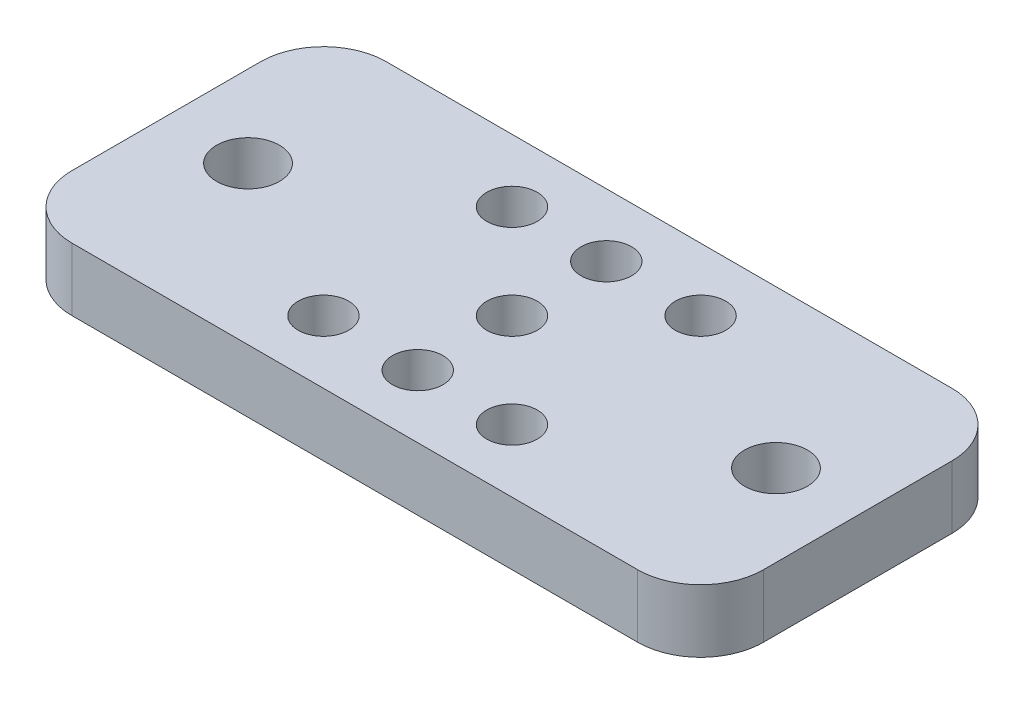
from build123d import *

# Parameters (mm, degrees)
SKETCH1_R           = 2.552698787
SKETCH1_R_2         = 2.5527
SKETCH1_R_3         = 3.175
BOSS_EXTRUDE2_DEPTH = 3.175


with BuildPart() as part:
    # Sketch1 → Boss-Extrude2 (new, symmetric)
    with BuildSketch(Plane(origin=(0, 0, 0), x_dir=(1, 0, 0), z_dir=(0, 1, 0))):
        with BuildLine():
            Line((-28.575, -15.875), (28.575, -15.875))
            add(Edge.make_bspline(
                [(28.575, -15.875), (29.157862345, -15.875), (29.730465383, -15.768989089), (30.338469644, -15.656424047), (30.912401406, -15.429155712), (31.511428211, -15.191950117), (32.049781934, -14.839921496), (32.600578196, -14.479756719), (33.065128061, -14.015128061), (33.530435301, -13.549741898), (33.889921496, -12.999781934), (34.242433686, -12.460491153), (34.479155712, -11.862401406), (34.706715402, -11.287460745), (34.818989089, -10.680465383), (34.925, -10.107329034), (34.925, -9.525)],
                knots=[0, 0, 0, 0.125, 0.125, 0.25, 0.25, 0.375, 0.375, 0.5, 0.5, 0.625, 0.625, 0.75, 0.75, 0.875, 0.875, 1, 1, 1], degree=2))
            Line((34.925, -9.525), (34.925, 9.525))
            add(Edge.make_bspline(
                [(34.925, 9.525), (34.925, 10.107862345), (34.818989089, 10.680465383), (34.706424047, 11.288469644), (34.479155712, 11.862401406), (34.241950117, 12.461428211), (33.889921496, 12.999781934), (33.529756719, 13.550578196), (33.065128061, 14.015128061), (32.599741898, 14.480435301), (32.049781934, 14.839921496), (31.510491153, 15.192433686), (30.912401406, 15.429155712), (30.337460745, 15.656715402), (29.730465383, 15.768989089), (29.157329034, 15.875), (28.575, 15.875)],
                knots=[0, 0, 0, 0.125, 0.125, 0.25, 0.25, 0.375, 0.375, 0.5, 0.5, 0.625, 0.625, 0.75, 0.75, 0.875, 0.875, 1, 1, 1], degree=2))
            Line((28.575, 15.875), (-28.575, 15.875))
            add(Edge.make_bspline(
                [(-28.575, 15.875), (-29.157862345, 15.875), (-29.730465383, 15.768989089), (-30.338469644, 15.656424047), (-30.912401406, 15.429155712), (-31.511428211, 15.191950117), (-32.049781934, 14.839921496), (-32.600578196, 14.479756719), (-33.065128061, 14.015128061), (-33.530435301, 13.549741898), (-33.889921496, 12.999781934), (-34.242433686, 12.460491153), (-34.479155712, 11.862401406), (-34.706715402, 11.287460745), (-34.818989089, 10.680465383), (-34.925, 10.107329034), (-34.925, 9.525)],
                knots=[0, 0, 0, 0.125, 0.125, 0.25, 0.25, 0.375, 0.375, 0.5, 0.5, 0.625, 0.625, 0.75, 0.75, 0.875, 0.875, 1, 1, 1], degree=2))
            Line((-34.925, 9.525), (-34.925, -9.525))
            add(Edge.make_bspline(
                [(-34.925, -9.525), (-34.925, -10.107862345), (-34.818989089, -10.680465383), (-34.706424047, -11.288469644), (-34.479155712, -11.862401406), (-34.241950117, -12.461428211), (-33.889921496, -12.999781934), (-33.529756719, -13.550578196), (-33.065128061, -14.015128061), (-32.599741898, -14.4804353), (-32.049781934, -14.839921496), (-31.510491153, -15.192433686), (-30.912401406, -15.429155712), (-30.337460745, -15.656715402), (-29.730465383, -15.768989089), (-29.157329034, -15.875), (-28.575, -15.875)],
                knots=[0, 0, 0, 0.125, 0.125, 0.25, 0.25, 0.375, 0.375, 0.5, 0.5, 0.625, 0.625, 0.75, 0.75, 0.875, 0.875, 1, 1, 1], degree=2))
        make_face()
        with Locations(Location((-9.525, -9.525, 0), (0, 0, 270))):
            Circle(SKETCH1_R, mode=Mode.SUBTRACT)
        with Locations(Location((-9.525, 9.525, 0), (0, 0, 270))):
            Circle(SKETCH1_R_2, mode=Mode.SUBTRACT)
        with Locations(Location((-26.67, 0, 0), (0, 0, 270))):
            Circle(SKETCH1_R_3, mode=Mode.SUBTRACT)
        with Locations(Location((0, -9.525, 0), (0, 0, 270))):
            Circle(SKETCH1_R_2, mode=Mode.SUBTRACT)
        with Locations(Location((9.525, -9.525, 0), (0, 0, 270))):
            Circle(SKETCH1_R_2, mode=Mode.SUBTRACT)
        with Locations(Location((26.67, 0, 0), (0, 0, 270))):
            Circle(SKETCH1_R_3, mode=Mode.SUBTRACT)
        with Locations(Location((9.525, 9.525, 0), (0, 0, 270))):
            Circle(SKETCH1_R_2, mode=Mode.SUBTRACT)
        with Locations(Location((0, 9.525, 0), (0, 0, 270))):
            Circle(SKETCH1_R_2, mode=Mode.SUBTRACT)
        with Locations(Location((0, 0, 0), (0, 0, 270))):
            Circle(SKETCH1_R_2, mode=Mode.SUBTRACT)
    extrude(amount=BOSS_EXTRUDE2_DEPTH, both=True)


solid = part.part
